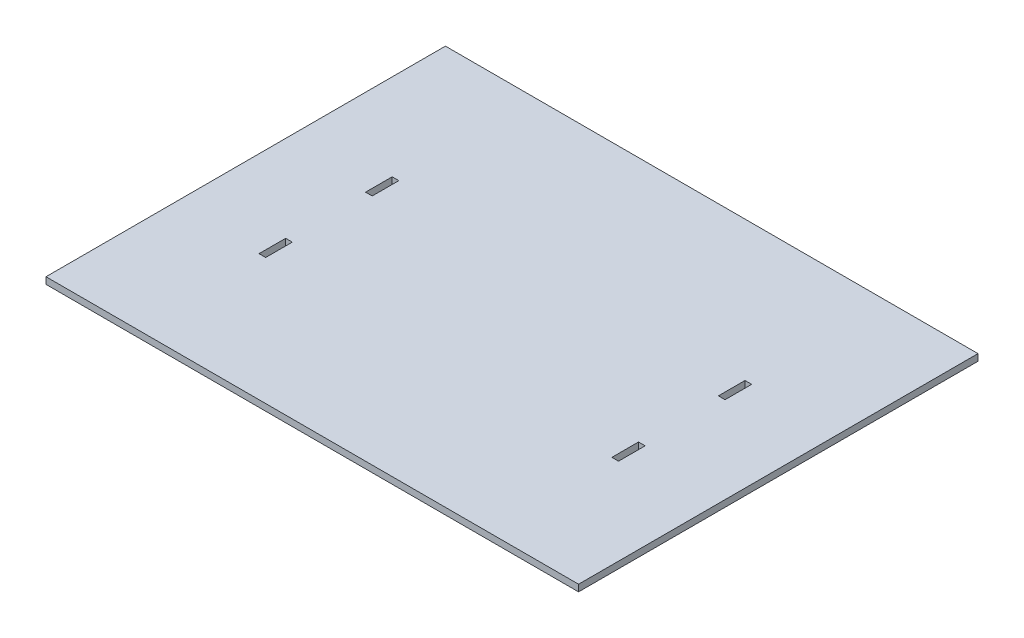
from build123d import *

# Parameters (mm, degrees)
SKETCH_1_W      = 400
SKETCH_1_H      = 300
SKETCH_1_W_2    = 5
SKETCH_1_H_2    = 20
EXTRUDE_1_DEPTH = 5


with BuildPart() as part:
    # 草圖1 → 填料-伸長1 (new body)
    with BuildSketch(Plane(origin=(0, 0, 0), x_dir=(1, 0, 0), z_dir=(0, 1, 0))):
        Rectangle(SKETCH_1_W, SKETCH_1_H)
        with Locations((-132.5, 35)):
            Rectangle(SKETCH_1_W_2, SKETCH_1_H_2, mode=Mode.SUBTRACT)
        with Locations((-132.5, -45)):
            Rectangle(SKETCH_1_W_2, SKETCH_1_H_2, mode=Mode.SUBTRACT)
        with Locations((132.5, 35)):
            Rectangle(SKETCH_1_W_2, SKETCH_1_H_2, mode=Mode.SUBTRACT)
        with Locations((132.5, -45)):
            Rectangle(SKETCH_1_W_2, SKETCH_1_H_2, mode=Mode.SUBTRACT)
    extrude(amount=EXTRUDE_1_DEPTH)


solid = part.part
